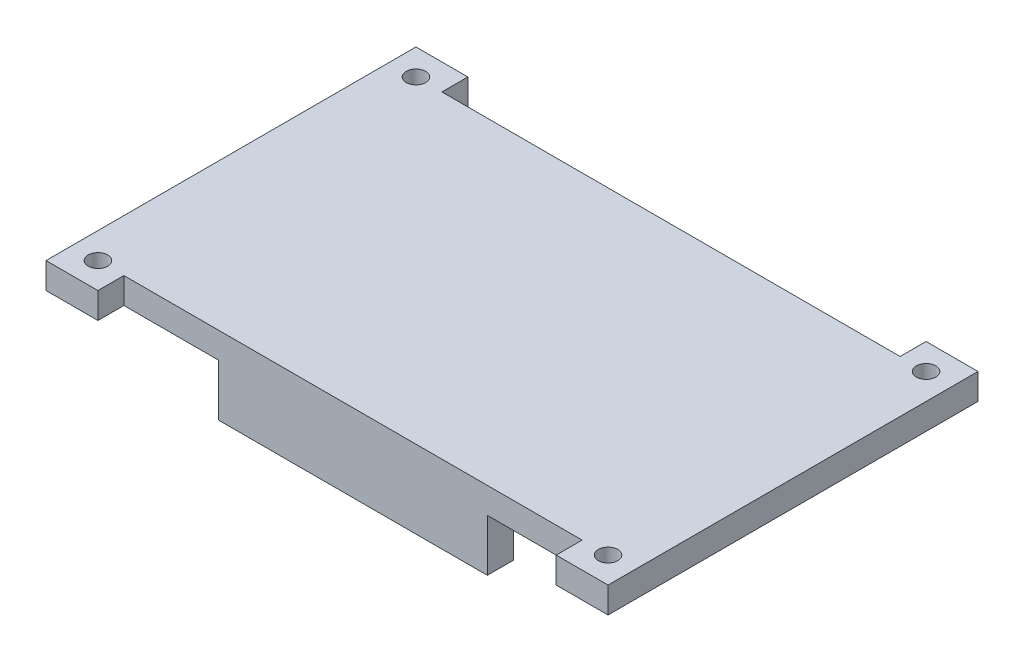
from build123d import *

# Parameters (mm, degrees)
SKETCH1_R           = 0.75
BOSS_EXTRUDE1_DEPTH = 2
SKETCH2_W           = 20.7
SKETCH2_H           = 2
SKETCH2_W_2         = 25.7
BOSS_EXTRUDE2_DEPTH = 4


with BuildPart() as part:
    # Sketch1 → Boss-Extrude1 (new body)
    # profile 1 of 3: a face of its own
    with BuildSketch(Plane(origin=(0, -22.368471217, 0), x_dir=(1, 0, 0), z_dir=(0, 1, 0))):
        Polygon((-7.325383597, 61.756641018), (1.674616403, 61.756641018), (1.674616403, 63.756641018), (-5.325383597, 63.756641018), (-5.325383597, 65.756641018), (-9.325383597, 65.756641018), (-9.325383597, 37.256641018), (-5.325383597, 37.256641018), (-5.325383597, 39.256641018), (1.674616403, 39.256641018), (1.674616403, 41.256641018), (-7.325383597, 41.256641018), align=None)
        with Locations(Location((-7.325383597, 63.756641018, 0), (0, 0, 270))):
            Circle(SKETCH1_R, mode=Mode.SUBTRACT)
        with Locations(Location((-7.325383597, 39.256641018, 0), (0, 0, 270))):
            Circle(SKETCH1_R, mode=Mode.SUBTRACT)
    # profile 2 of 3: a face of its own
    with BuildSketch(Plane(origin=(0, -22.368471217, 0), x_dir=(1, 0, 0), z_dir=(0, 1, 0))):
        Polygon((1.674616403, 39.256641018), (22.974616403, 39.256641018), (22.974616403, 41.256641018), (31.974616403, 41.256641018), (31.974616403, 61.756641018), (27.974616403, 61.756641018), (27.974616403, 63.756641018), (1.674616403, 63.756641018), (1.674616403, 61.756641018), (-7.325383597, 61.756641018), (-7.325383597, 41.256641018), (1.674616403, 41.256641018), align=None)
    # profile 3 of 3: a face of its own
    with BuildSketch(Plane(origin=(0, -22.368471217, 0), x_dir=(1, 0, 0), z_dir=(0, 1, 0))):
        Polygon((29.974616403, 65.756641018), (29.974616403, 63.756641018), (27.974616403, 63.756641018), (27.974616403, 61.756641018), (31.974616403, 61.756641018), (31.974616403, 41.256641018), (22.974616403, 41.256641018), (22.974616403, 39.256641018), (29.974616403, 39.256641018), (29.974616403, 37.256641018), (33.974616403, 37.256641018), (33.974616403, 65.756641018), align=None)
        with Locations(Location((31.974616403, 39.256641018, 0), (0, 0, 270))):
            Circle(SKETCH1_R, mode=Mode.SUBTRACT)
        with Locations(Location((31.974616403, 63.756641018, 0), (0, 0, 270))):
            Circle(SKETCH1_R, mode=Mode.SUBTRACT)
    extrude(amount=BOSS_EXTRUDE1_DEPTH)

    # Sketch2 → Boss-Extrude2 (add)
    with BuildSketch(Plane.XZ.offset(22.368471217)):
        with Locations((12.324616403, -40.256641018)):
            Rectangle(SKETCH2_W, SKETCH2_H)
        with Locations((14.824616403, -62.756641018)):
            Rectangle(SKETCH2_W_2, SKETCH2_H)
    extrude(amount=BOSS_EXTRUDE2_DEPTH)


solid = part.part
